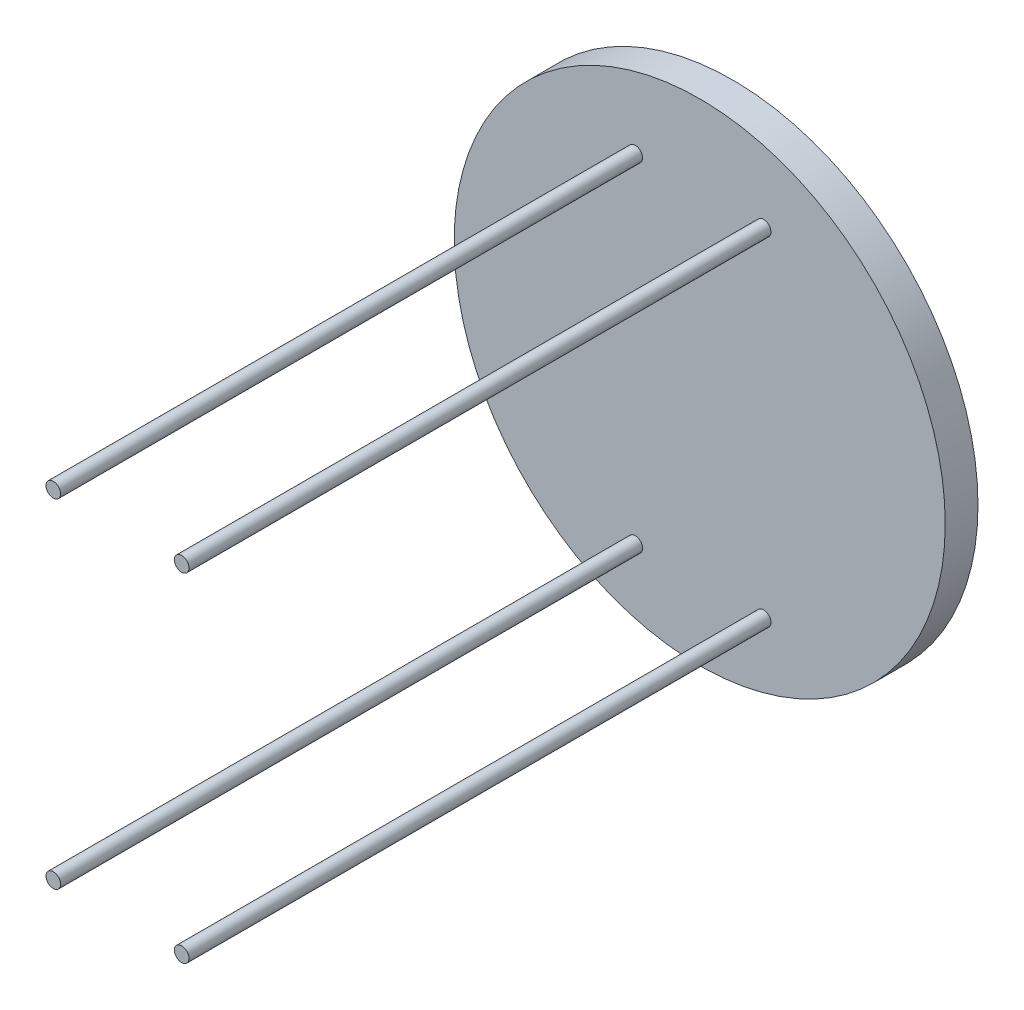
from build123d import *

# Parameters (mm, degrees)
SKETCH1_R           = 1304.092779863
BOSS_EXTRUDE1_DEPTH = 174
SKETCH3_R           = 38.771715285
SKETCH3_R_2         = 38.771715
BOSS_EXTRUDE2_DEPTH = 3091


with BuildPart() as part:
    # Sketch1 → Boss-Extrude1 (new body)
    with BuildSketch(Plane.XY.offset(943.510776168)):
        with Locations((833.930631376, -1197.16637306)):
            Circle(SKETCH1_R)
    extrude(amount=-BOSS_EXTRUDE1_DEPTH)

    # Sketch3 → Boss-Extrude2 (add)
    with BuildSketch(Plane.XY.offset(943.510776168)):
        with Locations((1173.639225527, -317.201613393)):
            Circle(SKETCH3_R)
        with Locations((491.765116758, -317.201613393)):
            Circle(SKETCH3_R_2)
        with Locations((491.765116758, -2112.860849235)):
            Circle(SKETCH3_R_2)
        with Locations((1173.639225527, -2112.860849235)):
            Circle(SKETCH3_R_2)
    extrude(amount=BOSS_EXTRUDE2_DEPTH)


solid = part.part
